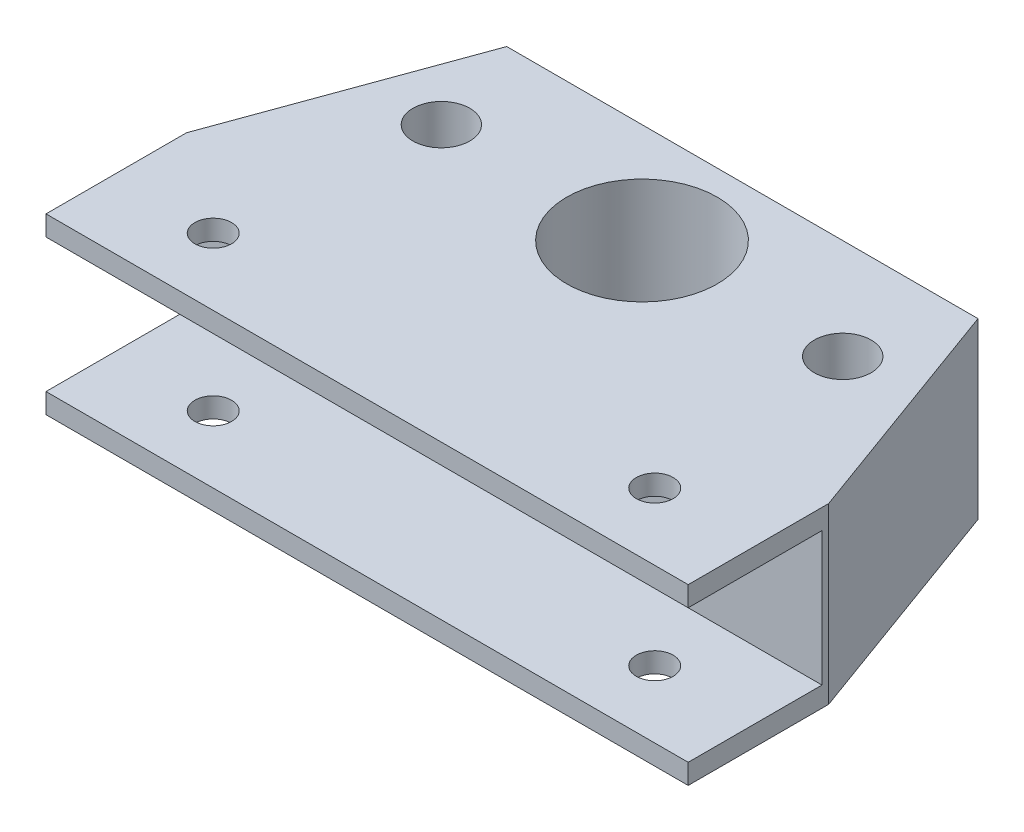
from build123d import *

# Parameters (mm, degrees)
SKETCH_1_R              = 11.25
SKETCH_1_R_2            = 4.25
EXTRUDE_1_DEPTH         = 13
SKETCH_2_W              = 20
SKETCH_2_H              = 20
CUT_EXTRUDE_1_DEPTH     = 108.071751643
CUT_EXTRUDE1_DEPTH      = 71.08823011
CUT_EXTRUDE1_DEPTH_BACK = 71.08823011
SKETCH1_R               = 2.75


with BuildPart() as part:
    # Эскиз1 → Бобышка-Вытянуть1 (new, symmetric)
    with BuildSketch(Plane(origin=(0, 0, 0), x_dir=(1, 0, 0), z_dir=(0, 1, 0))):
        Polygon((-48, -10.5), (48, -10.5), (48, 10.5), (35.224644777, 45.6), (0, 45.6), (-35.224644777, 45.6), (-48, 10.5), align=None)
        with Locations(Location((0, 30.6, 0), (0, 0, 90))):
            Circle(SKETCH_1_R, mode=Mode.SUBTRACT)
        with Locations(Location((-30, 30.6, 0), (0, 0, 90))):
            Circle(SKETCH_1_R_2, mode=Mode.SUBTRACT)
        with Locations(Location((30, 30.6, 0), (0, 0, 90))):
            Circle(SKETCH_1_R_2, mode=Mode.SUBTRACT)
    extrude(amount=EXTRUDE_1_DEPTH, both=True)

    # Эскиз2 → Вырез-Вытянуть1 (cut, through all)
    with BuildSketch(Plane.ZY.offset(48)):
        with Locations((0.5, 0)):
            Rectangle(SKETCH_2_W, SKETCH_2_H)
    extrude(amount=-CUT_EXTRUDE_1_DEPTH, mode=Mode.SUBTRACT)

    # Sketch1 → Cut-Extrude1 (cut, two sides: drawn at the far end of the back side and taken through both)
    with BuildSketch(Plane.XZ.offset(-10).offset(-CUT_EXTRUDE1_DEPTH_BACK)):
        with Locations(Location((-33, 0.5, 0), (0, 0, 270))):
            Circle(SKETCH1_R)
        with Locations(Location((33, 0.5, 0), (0, 0, 270))):
            Circle(SKETCH1_R)
    extrude(amount=CUT_EXTRUDE1_DEPTH + CUT_EXTRUDE1_DEPTH_BACK, mode=Mode.SUBTRACT)


solid = part.part
